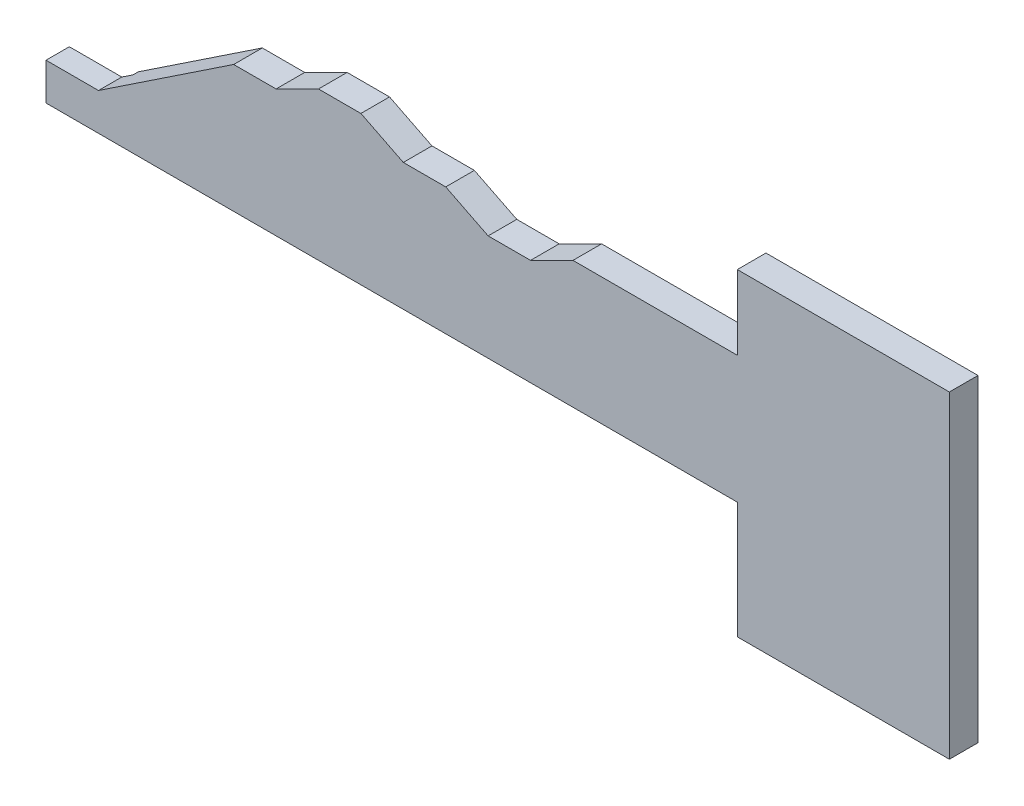
from build123d import *

# Parameters (mm, degrees)
BOSS_EXTRUDE1_DEPTH = 2.7
CUT_EXTRUDE1_START  = -2.7
SKETCH2_W           = 68.2
SKETCH2_H           = 1.4
CUT_EXTRUDE1_DEPTH  = 0.5


with BuildPart() as part:
    # Sketch1 → Boss-Extrude1 (new body)
    with BuildSketch(Plane.XY):
        Polygon((20, 15), (0, 15), (0, 8), (-15.5, 8), (-19.5, 6), (-23.5, 6), (-27.5, 8), (-31.5, 8), (-35.5, 10), (-39.5, 10), (-43.5, 8), (-47.5, 8), (-60.25, -0.5), (-65.2, -0.5), (-65.2, -4), (0, -4), (0, -15), (20, -15), align=None)
    extrude(amount=BOSS_EXTRUDE1_DEPTH)

    # Sketch2 → Cut-Extrude1 (cut)
    with BuildSketch(Plane.XY.offset(2.7).offset(CUT_EXTRUDE1_START)):
        with Locations((-31.1, -0.5)):
            Rectangle(SKETCH2_W, SKETCH2_H)
    extrude(amount=CUT_EXTRUDE1_DEPTH, mode=Mode.SUBTRACT)


solid = part.part
